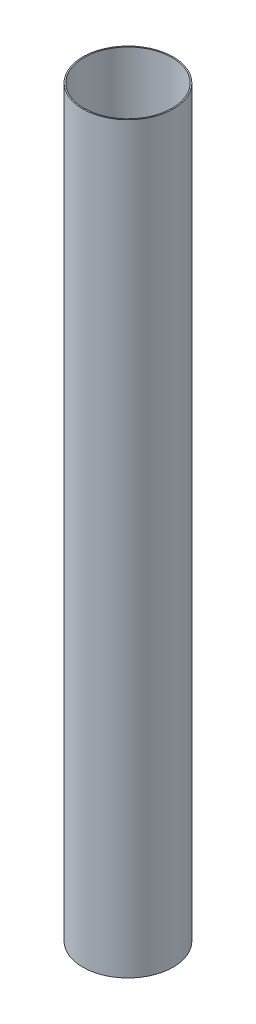
from build123d import *

# Parameters (mm, degrees)
SKETCH1_R           = 76
SKETCH1_R_2         = 74
BOSS_EXTRUDE2_DEPTH = 1250


with BuildPart() as part:
    # Sketch1 → Boss-Extrude2 (new body)
    with BuildSketch(Plane(origin=(0, 0, 0), x_dir=(1, 0, 0), z_dir=(0, 1, 0))):
        with Locations(Location((0, 0, 0), (0, 0, 270))):
            Circle(SKETCH1_R)
        with Locations(Location((0, 0, 0), (0, 0, 270))):
            Circle(SKETCH1_R_2, mode=Mode.SUBTRACT)
    extrude(amount=BOSS_EXTRUDE2_DEPTH)


solid = part.part
